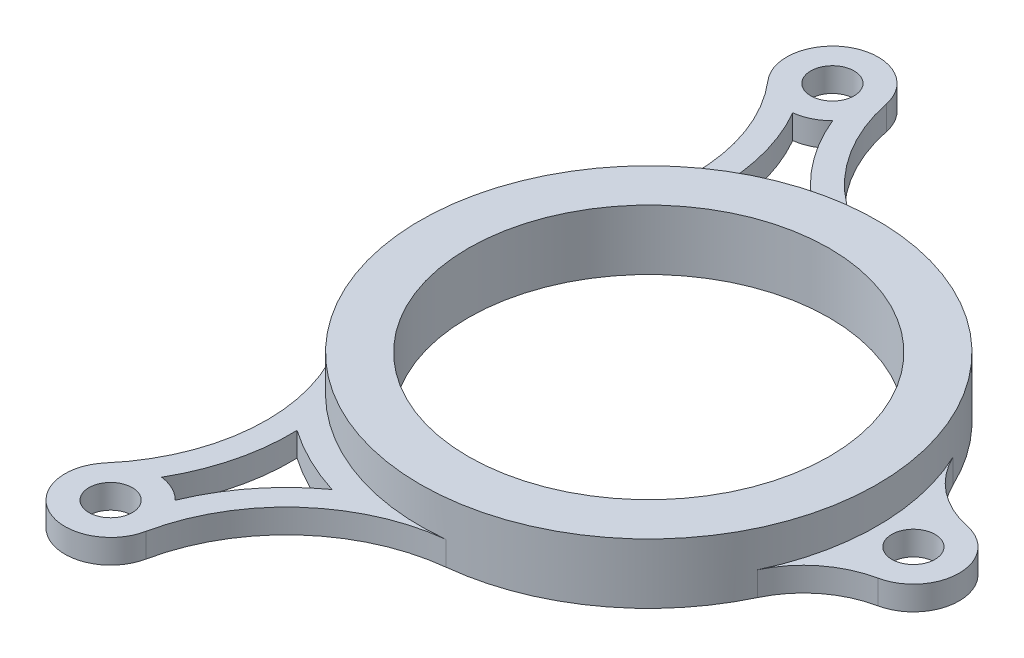
from build123d import *

# Parameters (mm, degrees)
SKETCH1_R           = 24.13
SKETCH1_R_2         = 19.05
BOSS_EXTRUDE1_DEPTH = 6.35
SKETCH2_R           = 2.286
BOSS_EXTRUDE2_DEPTH = 2.54
SKETCH3_R           = 2.286
BOSS_EXTRUDE3_DEPTH = 2.54


with BuildPart() as part:
    # Sketch1 → Boss-Extrude1 (new body)
    with BuildSketch(Plane(origin=(0, 0, 0), x_dir=(1, 0, 0), z_dir=(0, 1, 0))):
        with Locations(Location((0, 0, 0), (0, 0, 270))):
            Circle(SKETCH1_R)
        with Locations(Location((0, 0, 0), (0, 0, 270))):
            Circle(SKETCH1_R_2, mode=Mode.SUBTRACT)
    extrude(amount=BOSS_EXTRUDE1_DEPTH)

    # Sketch2 → Boss-Extrude2 (add)
    with BuildSketch(Plane.XZ):
        with BuildLine():
            Line((21.809620202, 10.324600072), (21.809620202, -10.324600072))
            ThreePointArc((21.809620202, -10.324600072), (24.708155319, -6.688622381), (28.923046533, -4.724816982))
            ThreePointArc((28.923046533, -4.724816982), (32.766, 0), (28.923046533, 4.724816982))
            ThreePointArc((28.923046533, 4.724816982), (24.708155319, 6.688622381), (21.809620202, 10.324600072))
        make_face()
        with Locations(Location((27.94, 0, 0), (0, 0, 270))):
            Circle(SKETCH2_R, mode=Mode.SUBTRACT)
    extrude(amount=-BOSS_EXTRUDE2_DEPTH)

    # Sketch3 → Boss-Extrude3 (add)
    # profile 1 of 2: a face of its own
    with BuildSketch(Plane.XZ):
        with BuildLine():
            ThreePointArc((-18.110069721, 33.3113894), (-20.447664077, 33.59782849), (-22.371361767, 34.956424059))
            ThreePointArc((-22.371361767, 34.956424059), (-17.836458254, 24.069997968), (-20.578970769, 12.600113575))
            ThreePointArc((-20.578970769, 12.600113575), (-10.636194217, 21.659369164), (2.611644249, 23.988251589))
            ThreePointArc((2.611644249, 23.988251589), (-8.141414639, 28.83091072), (-13.983266974, 39.075537809))
            ThreePointArc((-13.983266974, 39.075537809), (-14.084369292, 36.722630449), (-15.286943189, 34.697732735))
            ThreePointArc((-15.286943189, 34.697732735), (-12.284263254, 29.563582193), (-7.99462004, 25.443564027))
            ThreePointArc((-7.99462004, 25.443564027), (-11.755793609, 23.93930276), (-15.245764429, 21.882768723))
            ThreePointArc((-15.245764429, 21.882768723), (-15.883236559, 27.796246369), (-18.110069721, 33.3113894))
        make_face()
    # profile 2 of 2: a face of its own
    with BuildSketch(Plane.XZ):
        with BuildLine():
            ThreePointArc((-22.371361767, 34.956424059), (-16.582401157, 33.768126167), (-13.983266974, 39.075537809))
            ThreePointArc((-13.983266974, 39.075537809), (-20.836878843, 42.431873833), (-22.371361767, 34.956424059))
        make_face()
        with Locations(Location((-18.70964, 38.1, 0), (0, 0, 270))):
            Circle(SKETCH3_R, mode=Mode.SUBTRACT)
    boss_extrude3 = extrude(amount=-BOSS_EXTRUDE3_DEPTH)

    # Mirror1: Boss-Extrude3 across plane
    add(boss_extrude3.mirror(Plane.XY))


solid = part.part
